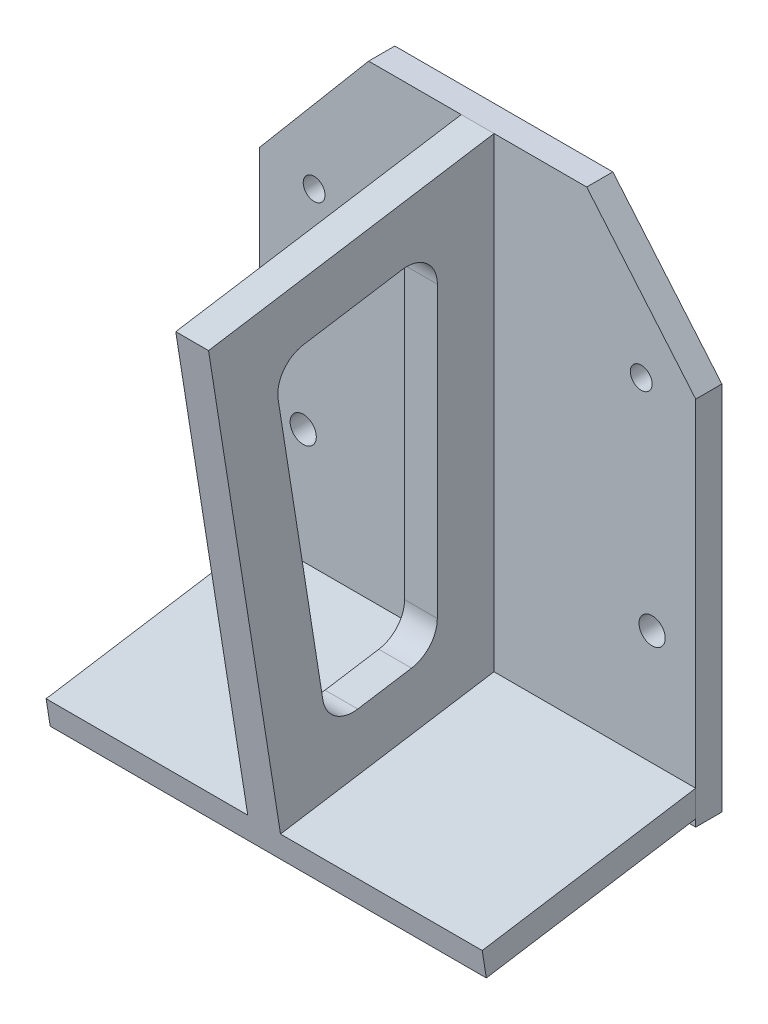
from build123d import *

# Parameters (mm, degrees)
BOSS_EXTRUDE1_DEPTH = 6
BOSS_EXTRUDE3_REACH = 101.785
CUT_EXTRUDE1_DEPTH  = 7.516274167
SKETCH4_R           = 2.5
SKETCH4_R_2         = 3
CUT_EXTRUDE2_DEPTH  = 10


with BuildPart() as part:
    # Sketch1 → Boss-Extrude1 (new body)
    with BuildSketch(Plane.XY):
        Polygon((-50, -68), (50, -68), (50, 17), (25, 46.620442646), (-25, 46.620442646), (-50, 17), align=None)
    extrude(amount=BOSS_EXTRUDE1_DEPTH)

    # Sketch4 → Cut-Extrude2 (cut)
    with BuildSketch(Plane(origin=(0, 0, 0), x_dir=(-1, 0, 0), z_dir=(0, 0, -1))):
        with Locations((37.5, 15)):
            Circle(SKETCH4_R)
        with Locations((40, -34)):
            Circle(SKETCH4_R_2)
        with Locations(Location((-37.5, 15, 0), (0, 0, 180))):
            Circle(SKETCH4_R)
        with Locations(Location((-40, -34, 0), (0, 0, 180))):
            Circle(SKETCH4_R_2)
    extrude(amount=-CUT_EXTRUDE2_DEPTH, mode=Mode.SUBTRACT)


with BuildPart() as body_2:
    # Boss-Extrude3: up to this plane
    boss_extrude3_end = Plane(origin=(0, 0, 6), z_dir=(0, 0, 1))
    # Sketch2 → Boss-Extrude3 (new, up to the surface)
    with BuildSketch(Plane(origin=(0, -10.155161239, 64.117164656), x_dir=(-1, 0, 0), z_dir=(0, 0.15643446504022426, -0.9876883405951389)), mode=Mode.PRIVATE) as boss_extrude3_sk1:
        Polygon((50, -64.584267711), (-50, -64.584267711), (-50, -58.584267711), (-3.741030689, -58.584267711), (-3.759259362, 46.984422973), (3.759259418, 46.985074426), (3.759259418, -58.584267711), (50, -58.584267711), align=None)
    boss_extrude3_tool1 = split(extrude(boss_extrude3_sk1.sketch, amount=BOSS_EXTRUDE3_REACH, mode=Mode.PRIVATE), bisect_by=boss_extrude3_end, keep=Keep.BOTH, mode=Mode.PRIVATE)
    add(boss_extrude3_tool1.solids().sort_by_distance((-0.002595, -39.607556, 59.452364))[0])

    # Sketch3 → Cut-Extrude1 (cut, along a direction that is not the sketch's normal)
    with BuildSketch(Plane.ZY.offset(3.759259418)):
        with BuildLine():
            Line((49.679834781, 26.540189826), (27.095041255, 30.117269708))
            ThreePointArc((27.095041255, 30.117269708), (21.453863662, 28.526293083), (19, 23.203451324))
            Line((19, 23.203451324), (19, -43.18322091))
            ThreePointArc((19, -43.18322091), (20.677158241, -47.729357249), (24.904958745, -50.097039294))
            Line((24.904958745, -50.097039294), (37.23244731, -52.049521672))
            ThreePointArc((37.23244731, -52.049521672), (42.441985332, -50.798822248), (45.24130695, -46.230744543))
            Line((45.24130695, -46.230744543), (55.49861191, 18.531330187))
            ThreePointArc((55.49861191, 18.531330187), (54.247912486, 23.740868208), (49.679834781, 26.540189826))
        make_face()
    extrude(amount=-CUT_EXTRUDE1_DEPTH, dir=(-0.9999999850923287, 0.00017054532892280964, 2.701172647133097e-05), mode=Mode.SUBTRACT)


solid = Compound([part.part, body_2.part])
